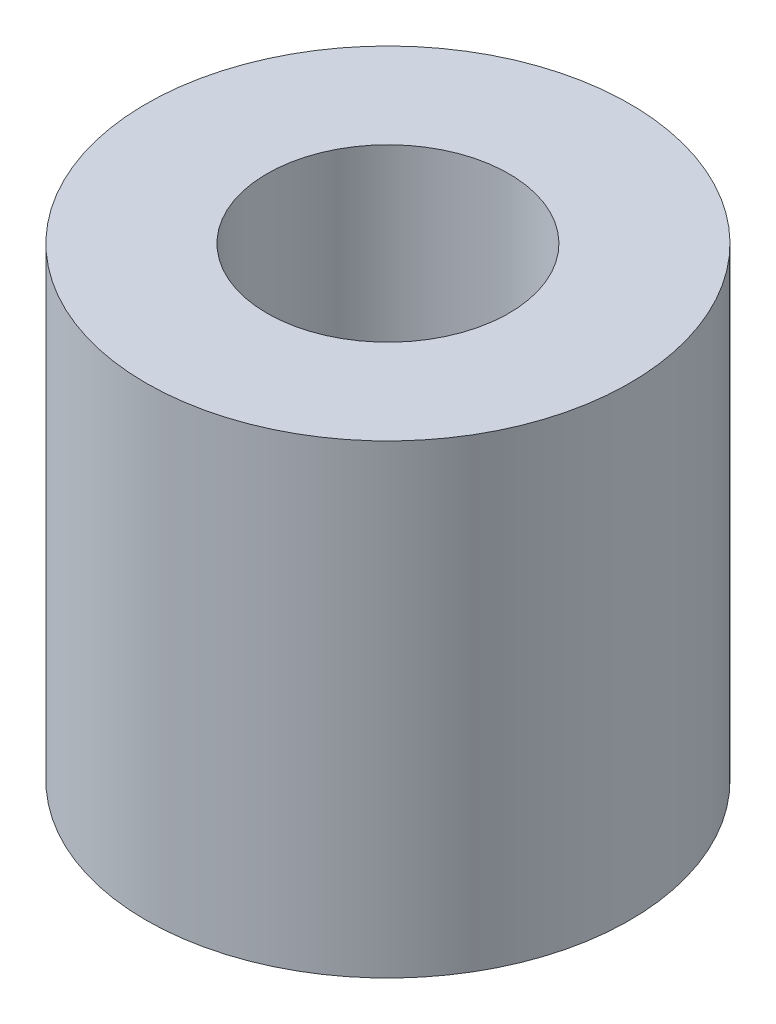
from build123d import *

# Parameters (mm, degrees)
SKETCH1_R           = 6.604
SKETCH1_R_2         = 3.302
BOSS_EXTRUDE1_DEPTH = 12.7


with BuildPart() as part:
    # Sketch1 → Boss-Extrude1 (new body)
    with BuildSketch(Plane(origin=(0, 0, 0), x_dir=(1, 0, 0), z_dir=(0, 1, 0))):
        with Locations(Location((0, 0, 0), (0, 0, 270))):
            Circle(SKETCH1_R)
        with Locations(Location((0, 0, 0), (0, 0, 270))):
            Circle(SKETCH1_R_2, mode=Mode.SUBTRACT)
    extrude(amount=BOSS_EXTRUDE1_DEPTH)


solid = part.part
